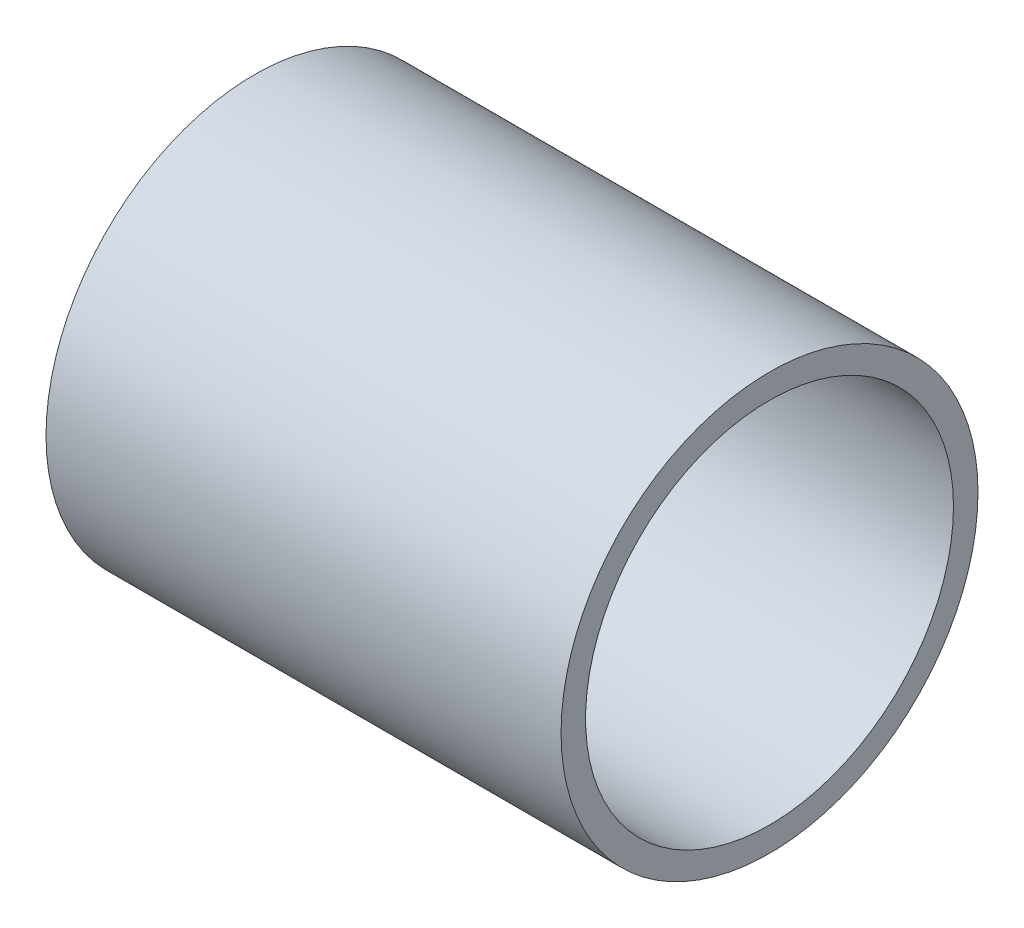
from build123d import *

# Parameters (mm, degrees)
SKETCH1_R           = 75
BOSS_EXTRUDE1_DEPTH = 200
SHELL1_T            = 10


with BuildPart() as part:
    # Sketch1 → Boss-Extrude1 (new body)
    with BuildSketch(Plane(origin=(0, 0, 0), x_dir=(0, 0, -1), z_dir=(1, 0, 0))):
        Circle(SKETCH1_R)
    extrude(amount=BOSS_EXTRUDE1_DEPTH)

    # Shell1
    shell1_openings = [part.faces().sort_by_distance(p)[0] for p in [
        (200, 0, 0),
    ]]
    offset(amount=SHELL1_T, openings=shell1_openings, kind=Kind.INTERSECTION)


solid = part.part
